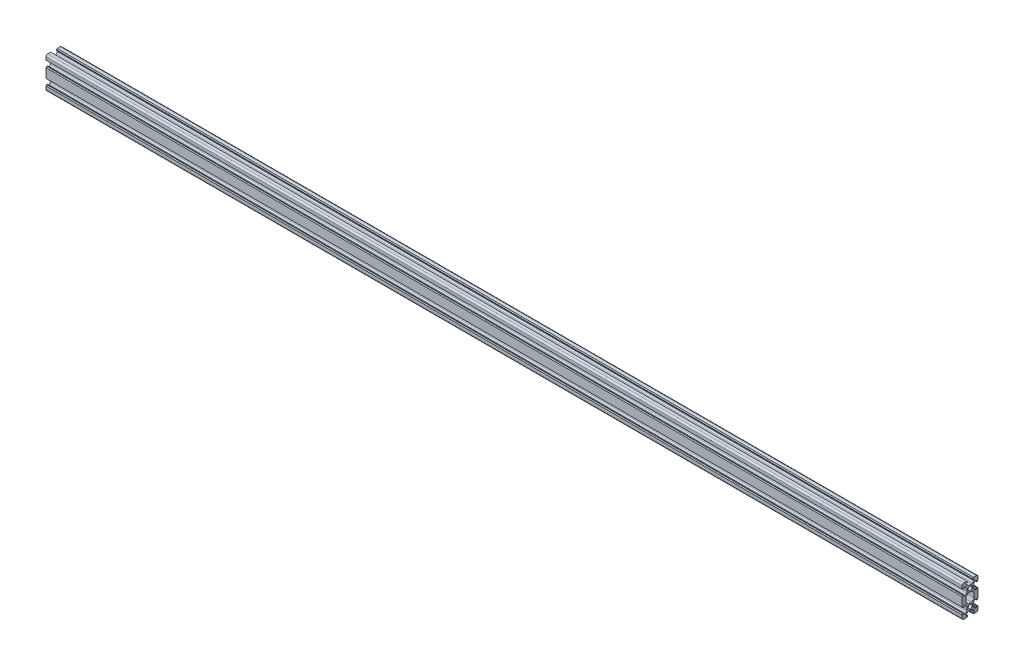
from build123d import *

# Parameters (mm, degrees)
SKETCH1_R           = 2.5
BOSS_EXTRUDE1_DEPTH = 1160


with BuildPart() as part:
    # Sketch1 → Boss-Extrude1 (new body)
    with BuildSketch(Plane(origin=(0, 0, 0), x_dir=(0, 0, -1), z_dir=(1, 0, 0))):
        with BuildLine():
            Line((6.9, 38), (5, 38))
            Line((5, 38), (5, 37.242640687))
            ThreePointArc((5, 37.242640687), (5.152240935, 36.477273822), (5.585786438, 35.828427125))
            Line((5.585786438, 35.828427125), (6.876358939, 34.537854624))
            ThreePointArc((6.876358939, 34.537854624), (7.525205636, 34.104309121), (8.290572501, 33.952068186))
            Line((8.290572501, 33.952068186), (11.709427499, 33.952068186))
            ThreePointArc((11.709427499, 33.952068186), (12.474794364, 34.104309121), (13.123641061, 34.537854624))
            Line((13.123641061, 34.537854624), (14.414213562, 35.828427125))
            ThreePointArc((14.414213562, 35.828427125), (14.847759065, 36.477273822), (15, 37.242640687))
            Line((15, 37.242640687), (15, 38))
            Line((15, 38), (13.1, 38))
            Line((13.1, 38), (13.1, 39))
            Line((13.1, 39), (14.1, 40))
            Line((14.1, 40), (18, 40))
            ThreePointArc((18, 40), (19.414213562, 39.414213562), (20, 38))
            Line((20, 38), (20, 34.1))
            Line((20, 34.1), (19, 33.1))
            Line((19, 33.1), (18, 33.1))
            Line((18, 33.1), (18, 35))
            Line((18, 35), (17.242640687, 35))
            ThreePointArc((17.242640687, 35), (16.477273822, 34.847759065), (15.828427125, 34.414213562))
            Line((15.828427125, 34.414213562), (14.537854624, 33.123641061))
            ThreePointArc((14.537854624, 33.123641061), (14.104309121, 32.474794364), (13.952068186, 31.709427499))
            Line((13.952068186, 31.709427499), (13.952068186, 28.290572501))
            ThreePointArc((13.952068186, 28.290572501), (14.104309121, 27.525205636), (14.537854624, 26.876358939))
            Line((14.537854624, 26.876358939), (15.828427125, 25.585786438))
            ThreePointArc((15.828427125, 25.585786438), (16.477273822, 25.152240935), (17.242640687, 25))
            Line((17.242640687, 25), (18, 25))
            Line((18, 25), (18, 26.9))
            Line((18, 26.9), (19, 26.9))
            Line((19, 26.9), (20, 25.9))
            Line((20, 25.9), (20, 14.1))
            Line((20, 14.1), (19, 13.1))
            Line((19, 13.1), (18, 13.1))
            Line((18, 13.1), (18, 15))
            Line((18, 15), (17.242640687, 15))
            ThreePointArc((17.242640687, 15), (16.477273822, 14.847759065), (15.828427125, 14.414213562))
            Line((15.828427125, 14.414213562), (14.537854624, 13.123641061))
            ThreePointArc((14.537854624, 13.123641061), (14.104309121, 12.474794364), (13.952068186, 11.709427499))
            Line((13.952068186, 11.709427499), (13.952068186, 8.290572501))
            ThreePointArc((13.952068186, 8.290572501), (14.104309121, 7.525205636), (14.537854624, 6.876358939))
            Line((14.537854624, 6.876358939), (15.828427125, 5.585786438))
            ThreePointArc((15.828427125, 5.585786438), (16.477273822, 5.152240935), (17.242640687, 5))
            Line((17.242640687, 5), (18, 5))
            Line((18, 5), (18, 6.9))
            Line((18, 6.9), (19, 6.9))
            Line((19, 6.9), (20, 5.9))
            Line((20, 5.9), (20, 2))
            ThreePointArc((20, 2), (19.414213562, 0.585786438), (18, 0))
            Line((18, 0), (14.1, 0))
            Line((14.1, 0), (13.1, 1))
            Line((13.1, 1), (13.1, 2))
            Line((13.1, 2), (15, 2))
            Line((15, 2), (15, 2.757359313))
            ThreePointArc((15, 2.757359313), (14.847759065, 3.522726178), (14.414213562, 4.171572875))
            Line((14.414213562, 4.171572875), (13.123641061, 5.462145376))
            ThreePointArc((13.123641061, 5.462145376), (12.474794364, 5.895690879), (11.709427499, 6.047931814))
            Line((11.709427499, 6.047931814), (8.290572501, 6.047931814))
            ThreePointArc((8.290572501, 6.047931814), (7.525205636, 5.895690879), (6.876358939, 5.462145376))
            Line((6.876358939, 5.462145376), (5.585786438, 4.171572875))
            ThreePointArc((5.585786438, 4.171572875), (5.152240935, 3.522726178), (5, 2.757359313))
            Line((5, 2.757359313), (5, 2))
            Line((5, 2), (6.9, 2))
            Line((6.9, 2), (6.9, 1))
            Line((6.9, 1), (5.9, 0))
            Line((5.9, 0), (2, 0))
            ThreePointArc((2, 0), (0.585786438, 0.585786438), (0, 2))
            Line((0, 2), (0, 5.9))
            Line((0, 5.9), (1, 6.9))
            Line((1, 6.9), (2, 6.9))
            Line((2, 6.9), (2, 5))
            Line((2, 5), (2.757359313, 5))
            ThreePointArc((2.757359313, 5), (3.522726178, 5.152240935), (4.171572875, 5.585786438))
            Line((4.171572875, 5.585786438), (5.462145376, 6.876358939))
            ThreePointArc((5.462145376, 6.876358939), (5.895690879, 7.525205636), (6.047931814, 8.290572501))
            Line((6.047931814, 8.290572501), (6.047931814, 11.709427499))
            ThreePointArc((6.047931814, 11.709427499), (5.895690879, 12.474794364), (5.462145376, 13.123641061))
            Line((5.462145376, 13.123641061), (4.171572875, 14.414213562))
            ThreePointArc((4.171572875, 14.414213562), (3.522726178, 14.847759065), (2.757359313, 15))
            Line((2.757359313, 15), (2, 15))
            Line((2, 15), (2, 13.1))
            Line((2, 13.1), (1, 13.1))
            Line((1, 13.1), (0, 14.1))
            Line((0, 14.1), (0, 25.9))
            Line((0, 25.9), (1, 26.9))
            Line((1, 26.9), (2, 26.9))
            Line((2, 26.9), (2, 25))
            Line((2, 25), (2.757359313, 25))
            ThreePointArc((2.757359313, 25), (3.522726178, 25.152240935), (4.171572875, 25.585786438))
            Line((4.171572875, 25.585786438), (5.462145376, 26.876358939))
            ThreePointArc((5.462145376, 26.876358939), (5.895690879, 27.525205636), (6.047931814, 28.290572501))
            Line((6.047931814, 28.290572501), (6.047931814, 31.709427499))
            ThreePointArc((6.047931814, 31.709427499), (5.895690879, 32.474794364), (5.462145376, 33.123641061))
            Line((5.462145376, 33.123641061), (4.171572875, 34.414213562))
            ThreePointArc((4.171572875, 34.414213562), (3.522726178, 34.847759065), (2.757359313, 35))
            Line((2.757359313, 35), (2, 35))
            Line((2, 35), (2, 33.1))
            Line((2, 33.1), (1, 33.1))
            Line((1, 33.1), (0, 34.1))
            Line((0, 34.1), (0, 38))
            ThreePointArc((0, 38), (0.585786438, 39.414213562), (2, 40))
            Line((2, 40), (5.9, 40))
            Line((5.9, 40), (6.9, 39))
            Line((6.9, 39), (6.9, 38))
        make_face()
        with Locations((10, 10)):
            Circle(SKETCH1_R, mode=Mode.SUBTRACT)
        with Locations((10, 30)):
            Circle(SKETCH1_R, mode=Mode.SUBTRACT)
        with BuildLine():
            Line((14.414213562, 15.828427125), (13.123641061, 14.537854624))
            ThreePointArc((13.123641061, 14.537854624), (12.474794364, 14.104309121), (11.709427499, 13.952068186))
            Line((11.709427499, 13.952068186), (8.290572501, 13.952068186))
            ThreePointArc((8.290572501, 13.952068186), (7.525205636, 14.104309121), (6.876358939, 14.537854624))
            Line((6.876358939, 14.537854624), (5.585786438, 15.828427125))
            ThreePointArc((5.585786438, 15.828427125), (5.152240935, 16.477273822), (5, 17.242640687))
            Line((5, 17.242640687), (5, 22.757359313))
            ThreePointArc((5, 22.757359313), (5.152240935, 23.522726178), (5.585786438, 24.171572875))
            Line((5.585786438, 24.171572875), (6.876358939, 25.462145376))
            ThreePointArc((6.876358939, 25.462145376), (7.525205636, 25.895690879), (8.290572501, 26.047931814))
            Line((8.290572501, 26.047931814), (11.709427499, 26.047931814))
            ThreePointArc((11.709427499, 26.047931814), (12.474794364, 25.895690879), (13.123641061, 25.462145376))
            Line((13.123641061, 25.462145376), (14.414213562, 24.171572875))
            ThreePointArc((14.414213562, 24.171572875), (14.847759065, 23.522726178), (15, 22.757359313))
            Line((15, 22.757359313), (15, 17.242640687))
            ThreePointArc((15, 17.242640687), (14.847759065, 16.477273822), (14.414213562, 15.828427125))
        make_face(mode=Mode.SUBTRACT)
    extrude(amount=BOSS_EXTRUDE1_DEPTH)


solid = part.part
